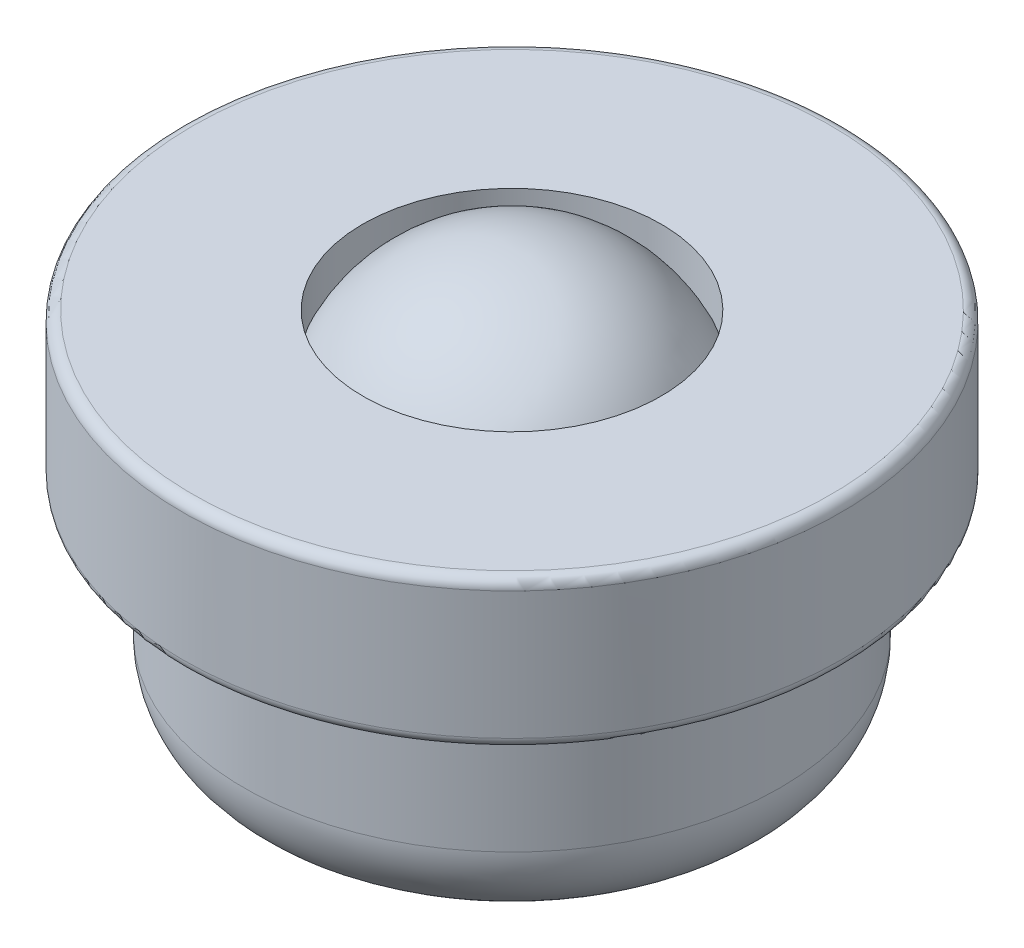
from build123d import *

# Parameters (mm, degrees)
CONG_1_R = 0.25


with BuildPart() as part:
    # Esquisse1 → Révolution1 (revolve)
    with BuildSketch(Plane.XY):
        with BuildLine():
            Line((0, 0), (-4.5, 0))
            ThreePointArc((-4.5, 0), (-5.914213562, 0.585786438), (-6.5, 2))
            Line((-6.5, 2), (-6.5, 5.2))
            Line((-6.5, 5.2), (-8, 5.2))
            Line((-8, 5.2), (-8, 8.8))
            Line((-8, 8.8), (-3.620773398, 8.8))
            Line((-3.620773398, 8.8), (-3.620773398, 7.8))
            ThreePointArc((-3.620773398, 7.8), (-2.144761059, 9.476388603), (0, 10.1))
            Line((0, 10.1), (0, 0))
        make_face()
    revolve(axis=Axis((0, 10.1, 0), (0, -1, 0)))

    # Congé1
    cong_1_edges = [part.edges().sort_by_distance(p)[0] for p in [
        (8, 8.8, 0),
        (8, 5.2, 0),
    ]]
    fillet(cong_1_edges, radius=CONG_1_R)


solid = part.part
